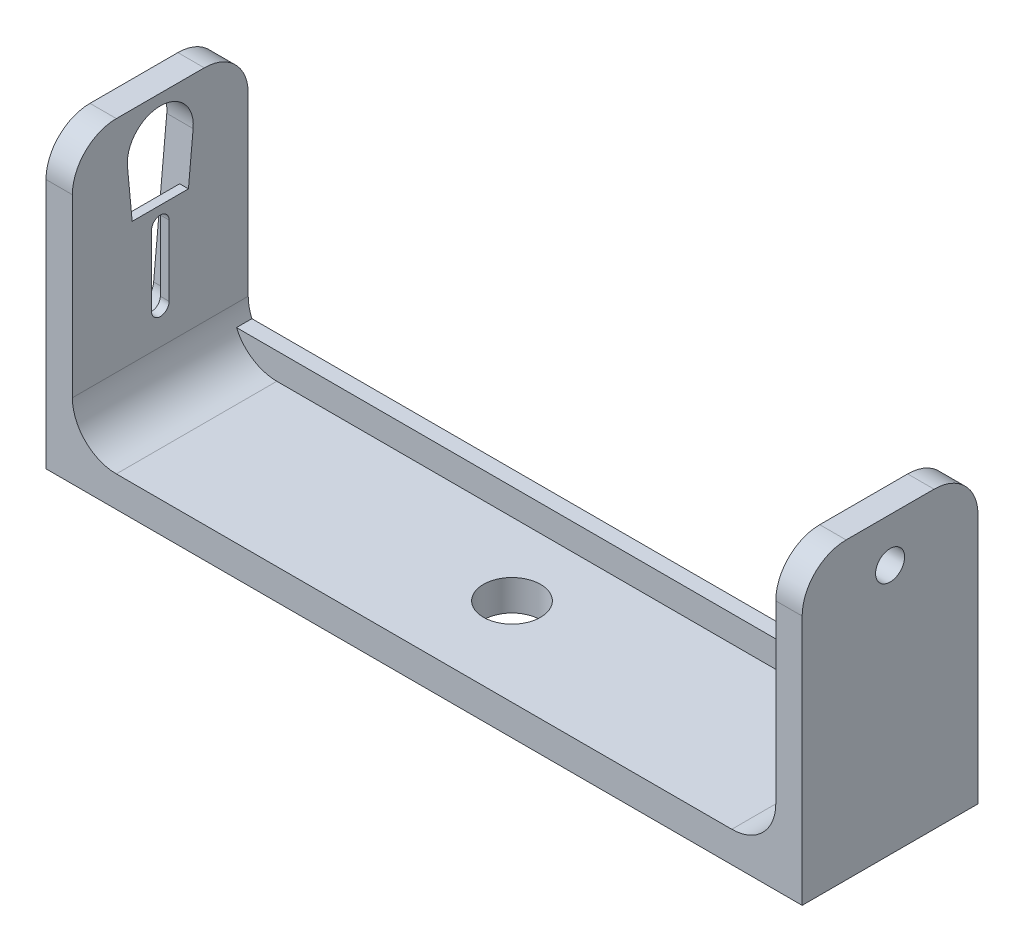
from build123d import *

# Parameters (mm, degrees)
SKETCH_1_W          = 86
SKETCH_1_H          = 20
EXTRUDE_1_DEPTH     = 3.5
SKETCH_2_R          = 3.25
CUT_EXTRUDE_1_DEPTH = 3.5
SKETCH_3_W          = 3
SKETCH_3_H          = 20
EXTRUDE_2_DEPTH     = 30
FILLET_1_R          = 5
FILLET_2_R          = 5
SKETCH_4_R          = 1.65
CUT_EXTRUDE_2_DEPTH = 91
FILLET_3_R          = 5
SKETCH_6_R          = 1.65
CUT_EXTRUDE_3_DEPTH = 2
SKETCH_7_R          = 1.65
CUT_EXTRUDE_4_DEPTH = 1
SKETCH_8_W          = 80.307081952
SKETCH_8_H          = 1.75
EXTRUDE_3_DEPTH     = 3


with BuildPart() as part:
    # 草图1 → 凸台-拉伸1 (new body)
    with BuildSketch(Plane(origin=(0, 0, 0), x_dir=(1, 0, 0), z_dir=(0, 1, 0))):
        Rectangle(SKETCH_1_W, SKETCH_1_H)
    extrude(amount=EXTRUDE_1_DEPTH)

    # 草图2 → 切除-拉伸1 (cut)
    with BuildSketch(Plane(origin=(0, 3.5, 0), x_dir=(1, 0, 0), z_dir=(0, 1, 0))):
        with Locations(Location((0, 0, 0), (0, 0, 270))):
            Circle(SKETCH_2_R)
    extrude(amount=-CUT_EXTRUDE_1_DEPTH, mode=Mode.SUBTRACT)

    # 草图3 → 凸台-拉伸2 (add)
    with BuildSketch(Plane(origin=(0, 3.5, 0), x_dir=(1, 0, 0), z_dir=(0, 1, 0))):
        with Locations((41.5, 0)):
            Rectangle(SKETCH_3_W, SKETCH_3_H)
        with Locations((-41.5, 0)):
            Rectangle(SKETCH_3_W, SKETCH_3_H)
    extrude(amount=EXTRUDE_2_DEPTH)

    # 圆角1
    fillet_1_edges = [part.edges().sort_by_distance(p)[0] for p in [
        (-40, 3.5, 0),
    ]]
    fillet(fillet_1_edges, radius=FILLET_1_R)

    # 圆角2
    fillet_2_edges = [part.edges().sort_by_distance(p)[0] for p in [
        (40, 3.5, 0),
    ]]
    fillet(fillet_2_edges, radius=FILLET_2_R)

    # 草图4 → 切除-拉伸2 (cut)
    with BuildSketch(Plane.ZY.offset(43)):
        with Locations((0, 28.5)):
            Circle(SKETCH_4_R)
    extrude(amount=-CUT_EXTRUDE_2_DEPTH, mode=Mode.SUBTRACT)

    # 圆角3
    fillet_3_edges = [part.edges().sort_by_distance(p)[0] for p in [
        (41.5, 33.5, -10),
        (41.5, 33.5, 10),
        (-41.5, 33.5, 10),
        (-41.5, 33.5, -10),
    ]]
    fillet(fillet_3_edges, radius=FILLET_3_R)

    # 草图6 → 切除-拉伸3 (cut)
    with BuildSketch(Plane.ZY.offset(43)):
        with BuildLine():
            Line((2.240090483, 12.2890625), (3.733484138, 28.1484375))
            ThreePointArc((3.733484138, 28.1484375), (0, 32.25), (-3.733484138, 28.1484375))
            Line((-3.733484138, 28.1484375), (-2.240090483, 12.2890625))
            ThreePointArc((-2.240090483, 12.2890625), (0, 10.25), (2.240090483, 12.2890625))
        make_face()
        with Locations((0, 28.5)):
            Circle(SKETCH_6_R, mode=Mode.SUBTRACT)
    extrude(amount=-CUT_EXTRUDE_3_DEPTH, mode=Mode.SUBTRACT)

    # 草图7 → 切除-拉伸4 (cut)
    # profile 1 of 3: a face of its own
    with BuildSketch(Plane.ZY.offset(41)):
        with BuildLine():
            ThreePointArc((3.75, 28.5), (-0.175975116, 32.245868759), (-3.733484138, 28.1484375))
            ThreePointArc((-3.733484138, 28.1484375), (0, 24.75), (3.733484138, 28.1484375))
            ThreePointArc((3.733484138, 28.1484375), (3.745868759, 28.324024884), (3.75, 28.5))
        make_face()
        with Locations((0, 28.5)):
            Circle(SKETCH_7_R, mode=Mode.SUBTRACT)
    # profile 2 of 3: a face of its own
    with BuildSketch(Plane.ZY.offset(41)):
        with BuildLine():
            Line((-3.733484138, 28.1484375), (-3.199423337, 22.476878304))
            Line((-3.199423337, 22.476878304), (3.199423337, 22.476878304))
            Line((3.199423337, 22.476878304), (3.733484138, 28.1484375))
            ThreePointArc((3.733484138, 28.1484375), (0, 24.75), (-3.733484138, 28.1484375))
        make_face()
    # profile 3 of 3: a face of its own
    with BuildSketch(Plane.ZY.offset(41)):
        with BuildLine():
            Line((-1, 20.5), (-1, 12.5))
            ThreePointArc((-1, 12.5), (0, 11.5), (1, 12.5))
            Line((1, 12.5), (1, 20.5))
            ThreePointArc((1, 20.5), (0, 21.5), (-1, 20.5))
        make_face()
    extrude(amount=-CUT_EXTRUDE_4_DEPTH, mode=Mode.SUBTRACT)

    # 草图8 → 凸台-拉伸3 (add)
    with BuildSketch(Plane(origin=(0, 3.5, 0), x_dir=(1, 0, 0), z_dir=(0, 1, 0))):
        with Locations((0.153540976, 9.125)):
            Rectangle(SKETCH_8_W, SKETCH_8_H)
    extrude(amount=EXTRUDE_3_DEPTH)


solid = part.part
